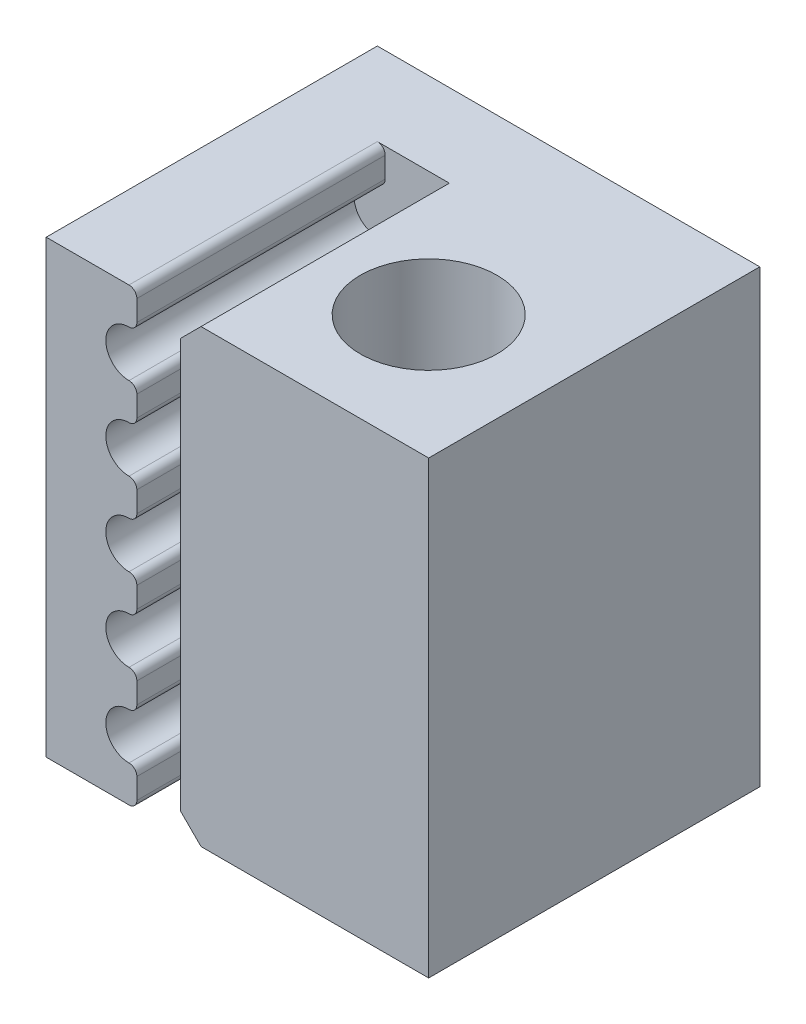
from build123d import *

# Parameters (mm, degrees)
AUFSATZ_LINEAR_AUSTRAGEN1_DEPTH   = 6
AUFSATZ_LINEAR_AUSTRAGEN1_2_DEPTH = 6
SKIZZE4_W                         = 9.24
SKIZZE4_H                         = 10.88
AUFSATZ_LINEAR_AUSTRAGEN2_DEPTH   = 2
SKIZZE3_R                         = 1.65
SCHNITT_LINEAR_AUSTRAGEN1_DEPTH   = 10.88
FASE1_SIZE                        = 0.5


with BuildPart() as part:
    # Skizze1 → Aufsatz-Linear austragen1 (new body)
    with BuildSketch(Plane.XY):
        Polygon((0, 0), (0, 9.44), (0, 10.88), (-6, 10.88), (-6, 0), align=None)
    extrude(amount=AUFSATZ_LINEAR_AUSTRAGEN1_DEPTH)



with BuildPart() as body_2:
    # Skizze1 → Aufsatz-Linear austragen1 2 (new body)
    with BuildSketch(Plane.XY):
        with BuildLine():
            Line((-7.05, 10.19), (-7.05, 10.69))
            ThreePointArc((-7.05, 10.69), (-7.105649712, 10.824350288), (-7.24, 10.88))
            Line((-7.24, 10.88), (-9.24, 10.88))
            Line((-9.24, 10.88), (-9.24, 0))
            Line((-9.24, 0), (-7.24, 0))
            ThreePointArc((-7.24, 0), (-7.105649712, 0.055649712), (-7.05, 0.19))
            Line((-7.05, 0.19), (-7.05, 0.69))
            ThreePointArc((-7.05, 0.69), (-7.105649712, 0.824350288), (-7.24, 0.88))
            ThreePointArc((-7.24, 0.88), (-7.8, 1.44), (-7.24, 2))
            ThreePointArc((-7.24, 2), (-7.105649712, 2.055649712), (-7.05, 2.19))
            Line((-7.05, 2.19), (-7.05, 2.69))
            ThreePointArc((-7.05, 2.69), (-7.105649712, 2.824350288), (-7.24, 2.88))
            ThreePointArc((-7.24, 2.88), (-7.8, 3.44), (-7.24, 4))
            ThreePointArc((-7.24, 4), (-7.105649712, 4.055649712), (-7.05, 4.19))
            Line((-7.05, 4.19), (-7.05, 4.69))
            ThreePointArc((-7.05, 4.69), (-7.105649712, 4.824350288), (-7.24, 4.88))
            ThreePointArc((-7.24, 4.88), (-7.8, 5.44), (-7.24, 6))
            ThreePointArc((-7.24, 6), (-7.105649712, 6.055649712), (-7.05, 6.19))
            Line((-7.05, 6.19), (-7.05, 6.69))
            ThreePointArc((-7.05, 6.69), (-7.105649712, 6.824350288), (-7.24, 6.88))
            ThreePointArc((-7.24, 6.88), (-7.8, 7.44), (-7.24, 8))
            ThreePointArc((-7.24, 8), (-7.105649712, 8.055649712), (-7.05, 8.19))
            Line((-7.05, 8.19), (-7.05, 8.69))
            ThreePointArc((-7.05, 8.69), (-7.105649712, 8.824350288), (-7.24, 8.88))
            ThreePointArc((-7.24, 8.88), (-7.8, 9.44), (-7.24, 10))
            ThreePointArc((-7.24, 10), (-7.105649712, 10.055649712), (-7.05, 10.19))
        make_face()
    extrude(amount=AUFSATZ_LINEAR_AUSTRAGEN1_2_DEPTH)


with BuildPart() as part_1:
    add(part.part)

    add(body_2.part)  # Aufsatz-Linear austragen2 merges body 2
    # Skizze4 → Aufsatz-Linear austragen2 (add)
    with BuildSketch(Plane(origin=(0, 0, 0), x_dir=(-1, 0, 0), z_dir=(0, 0, -1))):
        with Locations((4.62, 5.44)):
            Rectangle(SKIZZE4_W, SKIZZE4_H)
    extrude(amount=AUFSATZ_LINEAR_AUSTRAGEN2_DEPTH)

    # Skizze3 → Schnitt-Linear austragen1 (cut)
    with BuildSketch(Plane(origin=(0, 10.88, 0), x_dir=(1, 0, 0), z_dir=(0, 1, 0))):
        with Locations(Location((-3, -3, 0), (0, 0, 180))):
            Circle(SKIZZE3_R)
    extrude(amount=-SCHNITT_LINEAR_AUSTRAGEN1_DEPTH, mode=Mode.SUBTRACT)

    # Fase1
    fase1_edges = [part_1.edges().sort_by_distance(p)[0] for p in [
        (-6, 10.88, 3),
        (-6, 0, 3),
    ]]
    chamfer(fase1_edges, length=FASE1_SIZE)


solid = part_1.part
